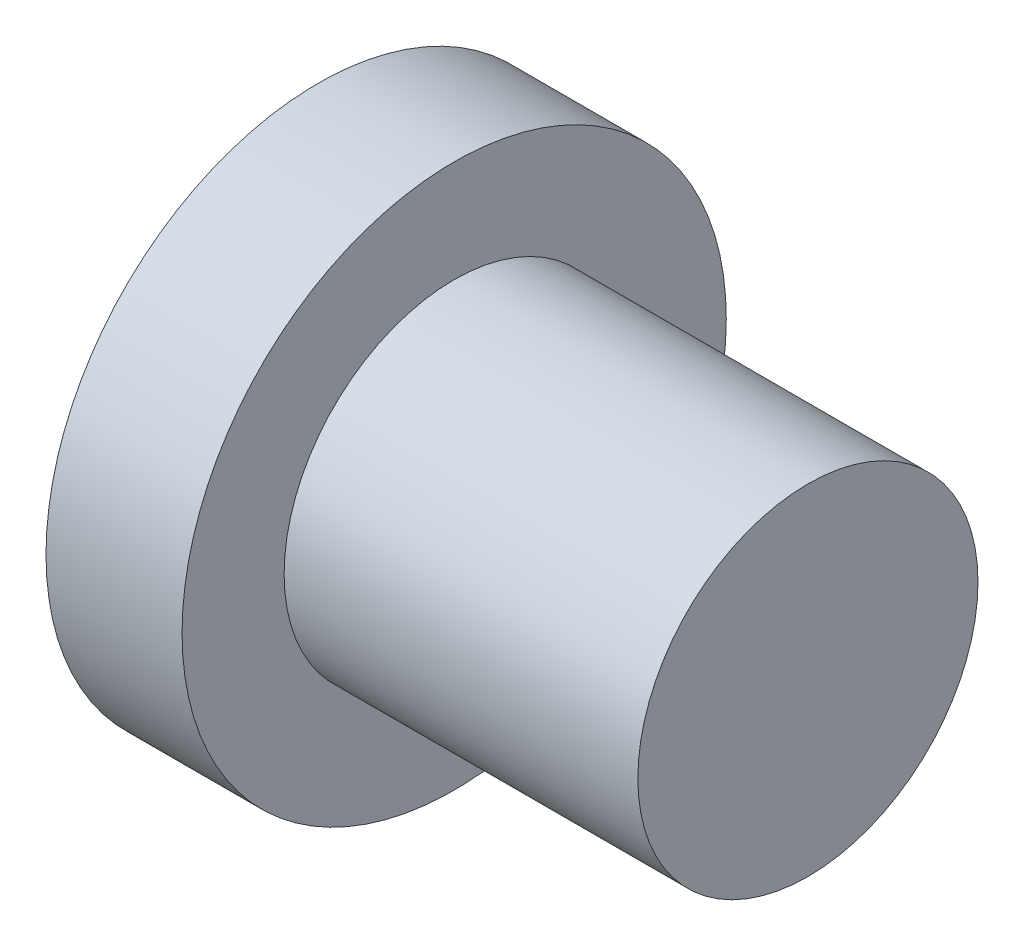
from build123d import *

# Parameters (mm, degrees)
SKETCH1_R           = 20
BOSS_EXTRUDE1_DEPTH = 10
SKETCH2_R           = 12.5
BOSS_EXTRUDE2_DEPTH = 26


with BuildPart() as part:
    # Sketch1 → Boss-Extrude1 (new body)
    with BuildSketch(Plane(origin=(0, 0, 0), x_dir=(0, 0, -1), z_dir=(1, 0, 0))):
        Circle(SKETCH1_R)
    extrude(amount=BOSS_EXTRUDE1_DEPTH)

    # Sketch2 → Boss-Extrude2 (add)
    with BuildSketch(Plane(origin=(10, 0, 0), x_dir=(0, 0, -1), z_dir=(1, 0, 0))):
        with Locations(Location((0, 0, 0), (0, 0, 180))):
            Circle(SKETCH2_R)
    extrude(amount=BOSS_EXTRUDE2_DEPTH)


solid = part.part
